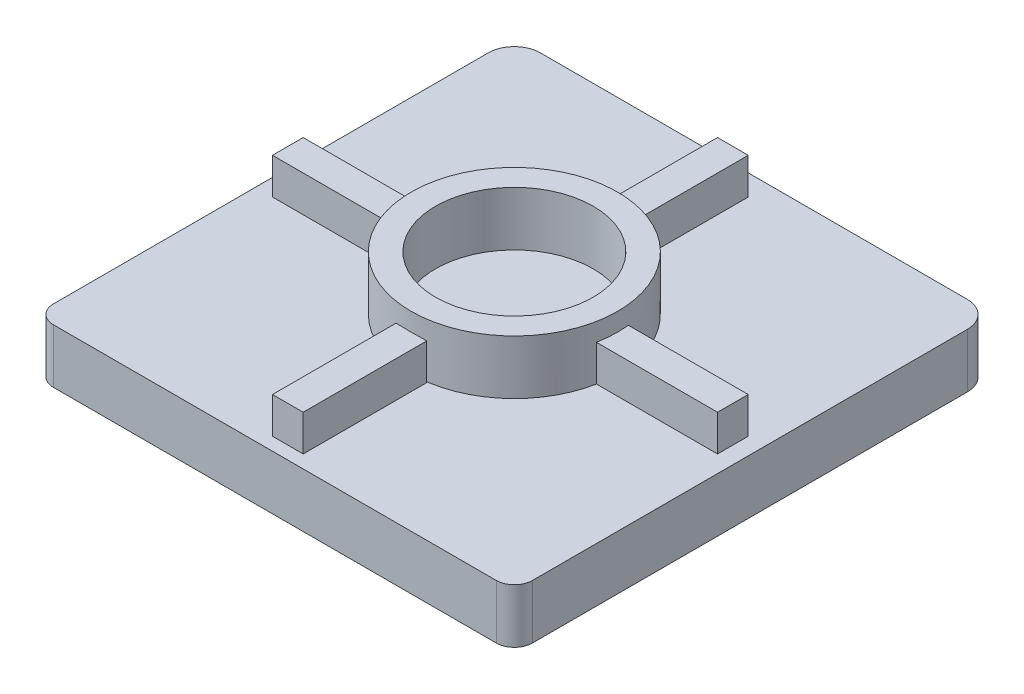
from build123d import *

# Parameters (mm, degrees)
EXTRUDE1_DEPTH = 9.525
SKETCH2_R      = 18.135228151
SKETCH2_R_2    = 13.849910733
EXTRUDE2_DEPTH = 9.525
SKETCH5_W      = 21.692133904
SKETCH5_H      = 5.39360198
SKETCH5_W_2    = 5.39360198
SKETCH5_H_2    = 21.692133904
SKETCH5_W_3    = 21.692133903
EXTRUDE4_DEPTH = 6.35


with BuildPart() as part:
    # Sketch1 → Extrude1 (new body)
    with BuildSketch(Plane(origin=(0, 0, 0), x_dir=(1, 0, 0), z_dir=(0, 1, 0))):
        with BuildLine():
            Line((80.952795926, -6.933070377), (3.175, -6.933070377))
            ThreePointArc((3.175, -6.933070377), (0.92993597, -6.003134407), (0, -3.758070377))
            Line((0, -3.758070377), (0, 72.612142843))
            ThreePointArc((0, 72.612142843), (1.339107796, 75.845035046), (4.572, 77.184142843))
            Line((4.572, 77.184142843), (79.555795926, 77.184142843))
            ThreePointArc((79.555795926, 77.184142843), (82.78868813, 75.845035046), (84.127795926, 72.612142843))
            Line((84.127795926, 72.612142843), (84.127795926, -3.758070377))
            ThreePointArc((84.127795926, -3.758070377), (83.197859957, -6.003134407), (80.952795926, -6.933070377))
        make_face()
    extrude(amount=-EXTRUDE1_DEPTH)

    # Sketch2 → Extrude2 (add)
    with BuildSketch(Plane(origin=(0, 0, 0), x_dir=(1, 0, 0), z_dir=(0, 1, 0))):
        with Locations(Location((42.063897963, 35.130827586, 0), (0, 0, 90))):
            Circle(SKETCH2_R)
        with Locations(Location((42.063897963, 35.130827586, 0), (0, 0, 90))):
            Circle(SKETCH2_R_2, mode=Mode.SUBTRACT)
    extrude(amount=EXTRUDE2_DEPTH)

    # Sketch5 → Extrude4 (add)
    with BuildSketch(Plane(origin=(0, 0, 0), x_dir=(1, 0, 0), z_dir=(0, 1, 0))):
        with Locations((70.300158538, 34.427036233)):
            Rectangle(SKETCH5_W, SKETCH5_H)
        with Locations((42.063897963, 6.190775658)):
            Rectangle(SKETCH5_W_2, SKETCH5_H_2)
        with Locations((13.827637389, 34.427036233)):
            Rectangle(SKETCH5_W_3, SKETCH5_H)
        with Locations((42.063897963, 62.663296808)):
            Rectangle(SKETCH5_W_2, SKETCH5_H_2)
    extrude(amount=EXTRUDE4_DEPTH)


solid = part.part
